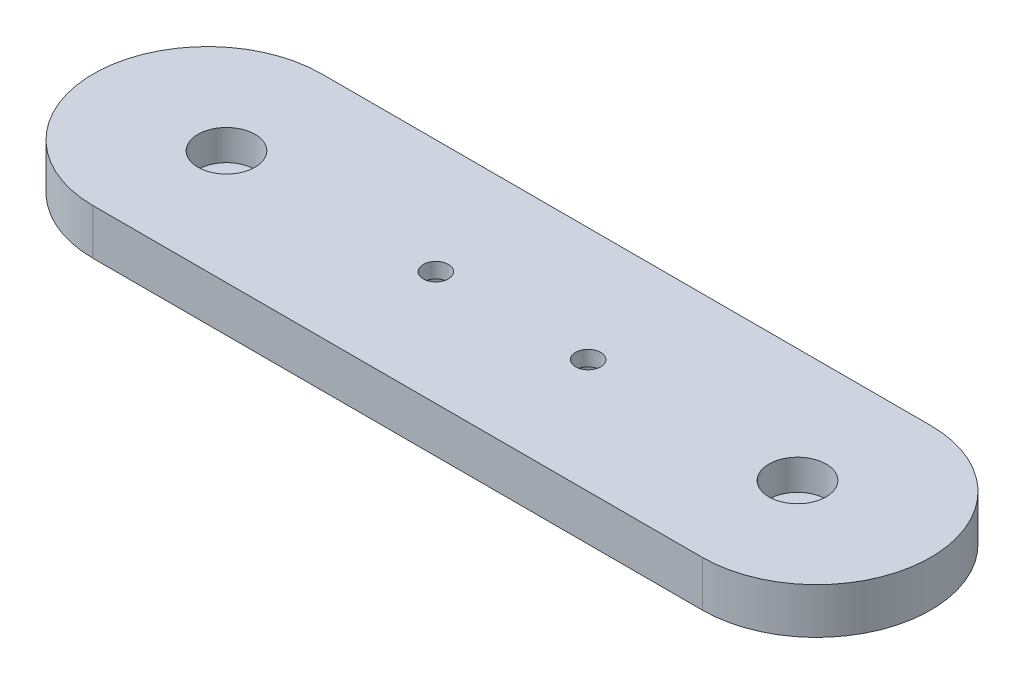
from build123d import *

# Parameters (mm, degrees)
BOSS_EXTRUDE1_DEPTH = 6
M4_TAPPED_HOLE5_D   = 3.3
LPATTERN3_COUNT     = 2
LPATTERN3_PITCH     = 75
LPATTERN4_COUNT     = 2
LPATTERN4_PITCH     = 20
SKETCH15_R          = 3.75
CUT_EXTRUDE1_DEPTH  = 4
SKETCH16_R          = 3.75
CUT_EXTRUDE3_DEPTH  = 4


with BuildPart() as part:
    # Sketch1 → Boss-Extrude1 (new body)
    with BuildSketch(Plane(origin=(0, 0, 0), x_dir=(1, 0, 0), z_dir=(0, 1, 0))):
        with BuildLine():
            Line((-40, 15), (40, 15))
            ThreePointArc((40, 15), (55, 0), (40, -15))
            Line((40, -15), (-40, -15))
            ThreePointArc((-40, -15), (-55, 0), (-40, 15))
        make_face()
    extrude(amount=BOSS_EXTRUDE1_DEPTH)

    # Sketch4 → M4 Tapped Hole3 (revolve, cut)
    with BuildSketch(Plane(origin=(37.5, 6, 0), x_dir=(0, 0, 1), z_dir=(1, 0, 0))):
        Polygon((0, 0), (0, 12.491420021), (1.65, 11.5), (1.65, 0), align=None)
    m4_tapped_hole3 = revolve(axis=Axis((37.5, 12.35, 0), (0, -1, 0)), mode=Mode.SUBTRACT)

    # M4 Tapped Hole5 (through all)
    with Locations(Plane(origin=(10, 6, 0), x_dir=(0, 0, 1), z_dir=(0, 1, 0))):
        with Locations((0, 0)):
            m4_tapped_hole5 = Hole(M4_TAPPED_HOLE5_D / 2)

    # LPattern3: M4 Tapped Hole3 ×2
    with Locations(*[(-i * LPATTERN3_PITCH, 0, 0) for i in range(1, LPATTERN3_COUNT)]):
        add(m4_tapped_hole3, mode=Mode.SUBTRACT)

    # LPattern4: M4 Tapped Hole5 ×2
    with Locations(*[(-i * LPATTERN4_PITCH, 0, 0) for i in range(1, LPATTERN4_COUNT)]):
        add(m4_tapped_hole5, mode=Mode.SUBTRACT)

    # Sketch15 → Cut-Extrude1 (cut)
    with BuildSketch(Plane(origin=(0, 6, 0), x_dir=(1, 0, 0), z_dir=(0, 1, 0))):
        with Locations(Location((37.5, 0, 0), (0, 0, 270))):
            Circle(SKETCH15_R)
        with Locations(Location((-37.5, 0, 0), (0, 0, 270))):
            Circle(SKETCH15_R)
    extrude(amount=-CUT_EXTRUDE1_DEPTH, mode=Mode.SUBTRACT)

    # Sketch16 → Cut-Extrude3 (cut)
    with BuildSketch(Plane.XZ):
        with Locations(Location((-10, 0, 0), (0, 0, 270))):
            Circle(SKETCH16_R)
        with Locations(Location((10, 0, 0), (0, 0, 270))):
            Circle(SKETCH16_R)
    extrude(amount=-CUT_EXTRUDE3_DEPTH, mode=Mode.SUBTRACT)


solid = part.part
